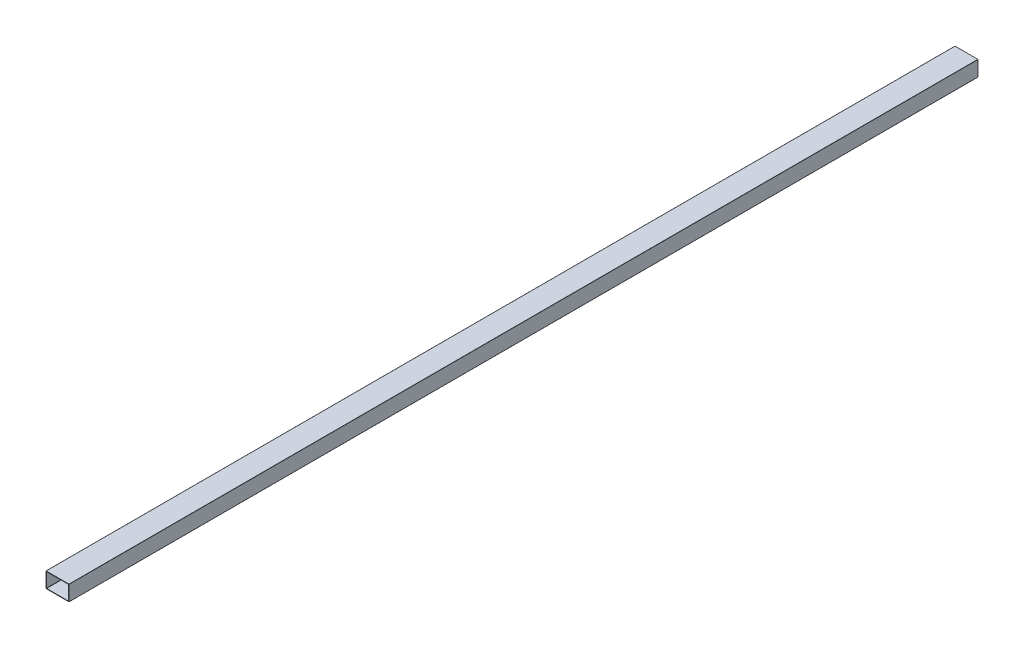
from build123d import *

# Parameters (mm, degrees)
CROQUIS1_W              = 152.4
CROQUIS1_H              = 101.6
CROQUIS1_W_2            = 146.32
CROQUIS1_H_2            = 95.52
SALIENTE_EXTRUIR1_DEPTH = 6000
REDONDEO1_R             = 1


with BuildPart() as part:
    # Croquis1 → Saliente-Extruir1 (new body)
    with BuildSketch(Plane.XY):
        Rectangle(CROQUIS1_W, CROQUIS1_H)
        Rectangle(CROQUIS1_W_2, CROQUIS1_H_2, mode=Mode.SUBTRACT)
    extrude(amount=-SALIENTE_EXTRUIR1_DEPTH)

    # Redondeo1
    redondeo1_edges = [part.edges().sort_by_distance(p)[0] for p in [
        (73.16, -47.76, -3000),
        (-73.16, -47.76, -3000),
        (-73.16, 47.76, -3000),
        (73.16, 47.76, -3000),
        (76.2, -50.8, -3000),
        (-76.2, -50.8, -3000),
        (-76.2, 50.8, -3000),
        (76.2, 50.8, -3000),
    ]]
    fillet(redondeo1_edges, radius=REDONDEO1_R)


solid = part.part
